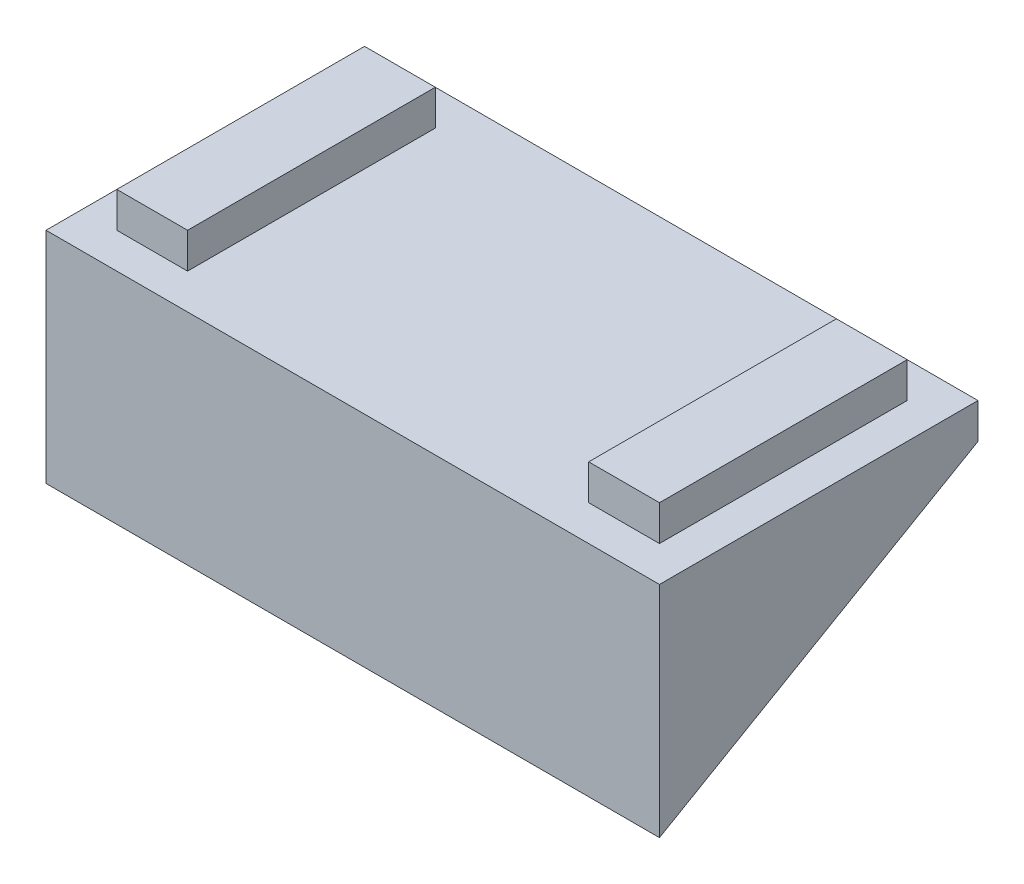
from build123d import *

# Parameters (mm, degrees)
SKETCH1_W             = 6
SKETCH1_H             = 21
BOSS_EXTRUDE1_DEPTH   = 3
BOSS_EXTRUDE1_2_DEPTH = 3
SKETCH1_3_W           = 52
SKETCH1_3_H           = 27
BOSS_EXTRUDE2_DEPTH   = 3
BOSS_EXTRUDE3_DEPTH   = 52


with BuildPart() as part:
    # Sketch1 → Boss-Extrude1 (new body)
    with BuildSketch(Plane(origin=(0, 0, 0), x_dir=(1, 0, 0), z_dir=(0, 1, 0))):
        with Locations((-20, 0)):
            Rectangle(SKETCH1_W, SKETCH1_H)
    extrude(amount=BOSS_EXTRUDE1_DEPTH)



with BuildPart() as body_2:
    # Sketch1 → Boss-Extrude1 2 (new body)
    with BuildSketch(Plane(origin=(0, 0, 0), x_dir=(1, 0, 0), z_dir=(0, 1, 0))):
        with Locations((20, 0)):
            Rectangle(SKETCH1_W, SKETCH1_H)
    extrude(amount=BOSS_EXTRUDE1_2_DEPTH)


with BuildPart() as body_3:
    # Sketch1<3> → Boss-Extrude2 (new body)
    with BuildSketch(Plane(origin=(0, 0, 0), x_dir=(1, 0, 0), z_dir=(0, 1, 0))):
        Rectangle(SKETCH1_3_W, SKETCH1_3_H)
    extrude(amount=-BOSS_EXTRUDE2_DEPTH)


with BuildPart() as part_1:
    add(part.part)

    add(body_2.part)  # Boss-Extrude3 merges body 2

    add(body_3.part)  # Boss-Extrude3 merges body 3
    # Sketch2 → Boss-Extrude3 (add)
    with BuildSketch(Plane.ZY.offset(26)):
        Polygon((13.5, -3), (13.5, -18.588457268), (-13.5, -3), (-13.5, 0), (13.5, 0), align=None)
    extrude(amount=-BOSS_EXTRUDE3_DEPTH)


solid = part_1.part
